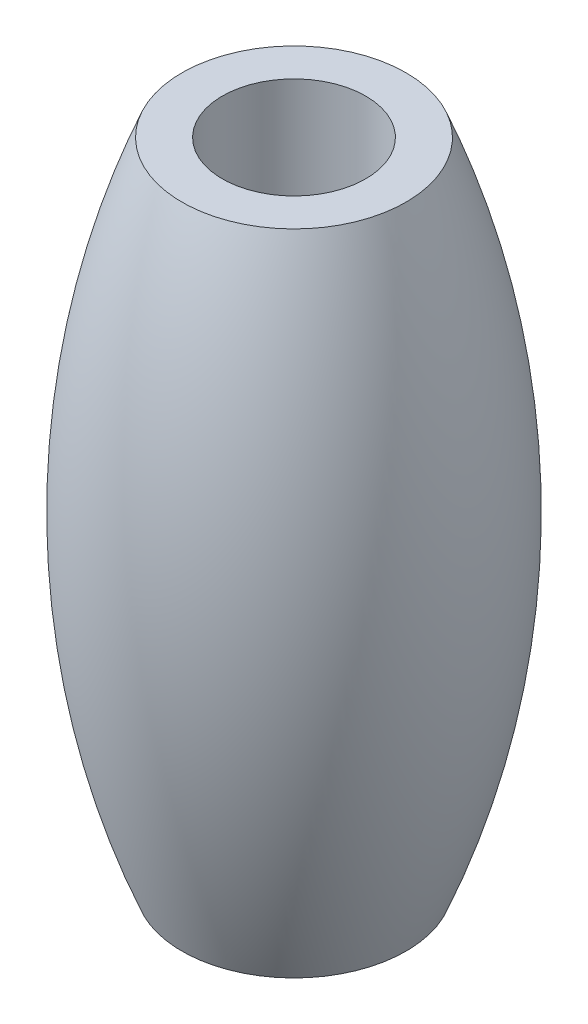
from build123d import *


with BuildPart() as part:
    # Sketch1 → Revolve1 (revolve)
    with BuildSketch(Plane.XY, mode=Mode.PRIVATE) as revolve1_sk:
        with BuildLine():
            Line((7.62, 0), (7.62, 68.896208335))
            Line((7.62, 68.896208335), (11.903284094, 68.896208335))
            ThreePointArc((11.903284094, 68.896208335), (18.569494518, 34.448104168), (11.903284094, 0))
            Line((11.903284094, 0), (7.62, 0))
        make_face()
    revolve(revolve1_sk.sketch.rotate(Axis((0, 0, 0), (0, 1, 0)), 90), axis=Axis((0, 0, 0), (0, 1, 0)))


solid = part.part
